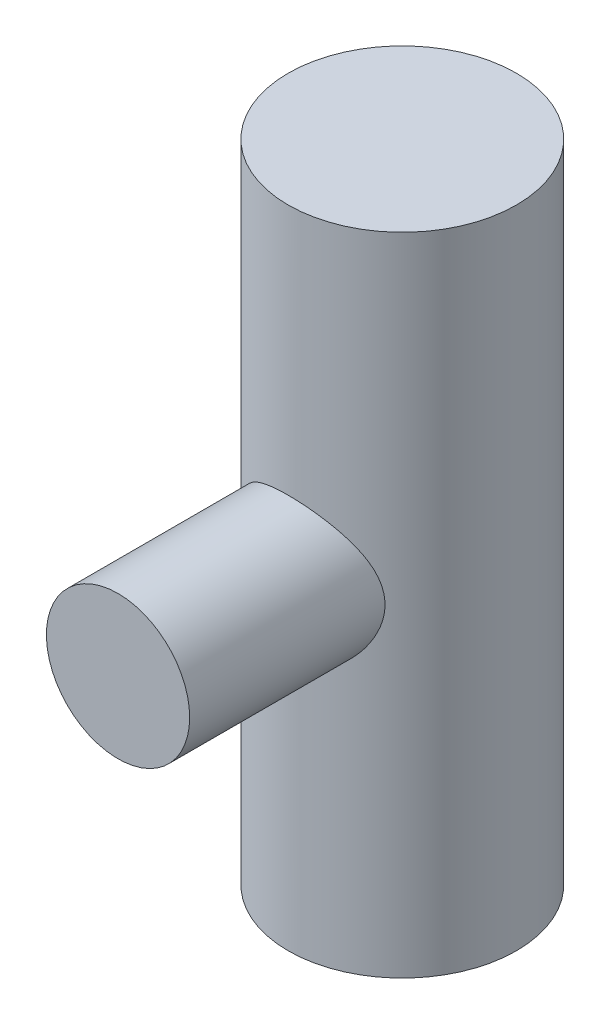
from build123d import *

# Parameters (mm, degrees)
BOSS_EXTRUDE1_DEPTH      = 36.068
BOSS_EXTRUDE1_DEPTH_BACK = 36.068
SKETCH1_R                = 12.75
SKETCH2_R                = 8
BOSS_EXTRUDE2_DEPTH      = 31.75


with BuildPart() as part:
    # Sketch1 → Boss-Extrude1 (new, two sides: drawn at the far end of the back side and taken through both)
    with BuildSketch(Plane(origin=(0, 0, 0), x_dir=(1, 0, 0), z_dir=(0, 1, 0)).offset(-BOSS_EXTRUDE1_DEPTH_BACK)):
        Circle(SKETCH1_R)
    extrude(amount=BOSS_EXTRUDE1_DEPTH + BOSS_EXTRUDE1_DEPTH_BACK)

    # Sketch2 → Boss-Extrude2 (add)
    with BuildSketch(Plane.XY):
        Circle(SKETCH2_R)
    extrude(amount=BOSS_EXTRUDE2_DEPTH)


solid = part.part
